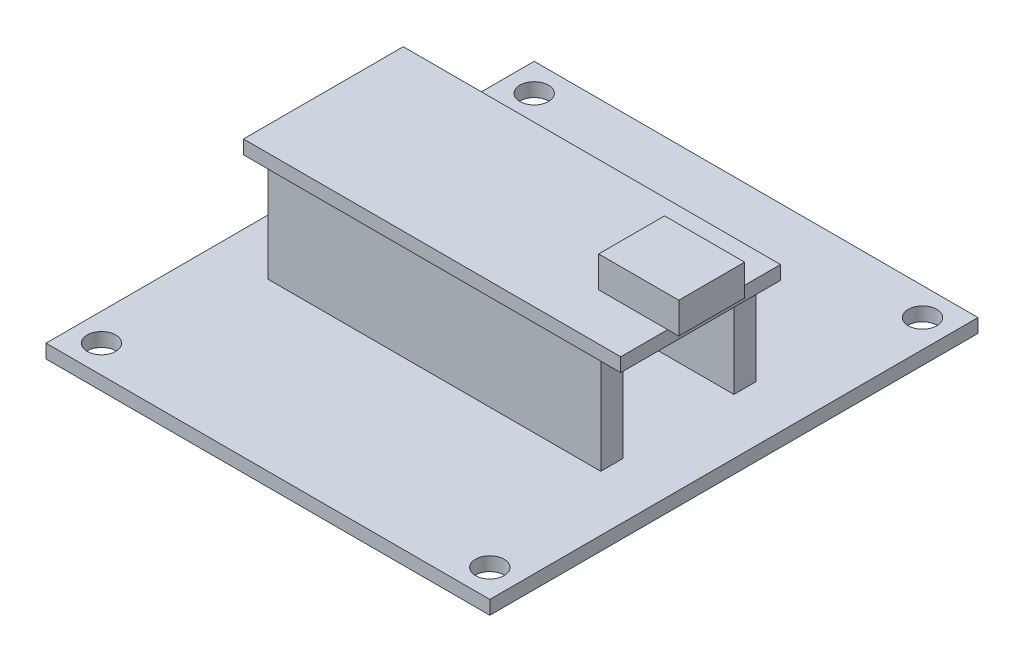
from build123d import *

# Parameters (mm, degrees)
SKETCH1_W                 = 50.8
SKETCH1_H                 = 55.88
BOSS_EXTRUDE1_DEPTH       = 1.5748
F_4_CLEARANCE_HOLE1_D     = 3.2639
F_4_CLEARANCE_HOLE1_DEPTH = 76.2
F_4_CLEARANCE_HOLE1_TIP   = 0.980574487
SKETCH4_W                 = 38.1
SKETCH4_H                 = 2.54
BOSS_EXTRUDE2_DEPTH       = 11.176
SKETCH5_W                 = 43.18
SKETCH5_H                 = 18.288
BOSS_EXTRUDE3_DEPTH       = 1.5748
SKETCH6_W                 = 9.1694
SKETCH6_H                 = 7.5438
BOSS_EXTRUDE4_DEPTH       = 3.556


with BuildPart() as part:
    # Sketch1 → Boss-Extrude1 (new body)
    with BuildSketch(Plane(origin=(0, 0, 0), x_dir=(1, 0, 0), z_dir=(0, 1, 0))):
        Rectangle(SKETCH1_W, SKETCH1_H)
    extrude(amount=BOSS_EXTRUDE1_DEPTH)

    # #4 Clearance Hole1
    with Locations(Plane(origin=(0, 1.5748, 0), x_dir=(-1, 0, 0), z_dir=(0, 1, 0))):
        with Locations((22.225, 24.765), (22.225, -24.765), (-22.225, -24.765), (-22.225, 24.765)):
            Hole(F_4_CLEARANCE_HOLE1_D / 2, depth=F_4_CLEARANCE_HOLE1_DEPTH)
            with Locations((0, 0, -(F_4_CLEARANCE_HOLE1_DEPTH + F_4_CLEARANCE_HOLE1_TIP / 2))):  # 118° drill point
                Cone(0, F_4_CLEARANCE_HOLE1_D / 2, F_4_CLEARANCE_HOLE1_TIP, mode=Mode.SUBTRACT)

    # Sketch4 → Boss-Extrude2 (add)
    with BuildSketch(Plane(origin=(0, 1.5748, 0), x_dir=(1, 0, 0), z_dir=(0, 1, 0))):
        with Locations((0, -7.62)):
            Rectangle(SKETCH4_W, SKETCH4_H)
        with Locations((0, 7.62)):
            Rectangle(SKETCH4_W, SKETCH4_H)
    extrude(amount=BOSS_EXTRUDE2_DEPTH)

    # Sketch5 → Boss-Extrude3 (add)
    with BuildSketch(Plane(origin=(0, 12.7508, 0), x_dir=(1, 0, 0), z_dir=(0, 1, 0))):
        Rectangle(SKETCH5_W, SKETCH5_H)
    extrude(amount=BOSS_EXTRUDE3_DEPTH)

    # Sketch6 → Boss-Extrude4 (add)
    with BuildSketch(Plane(origin=(0, 14.3256, 0), x_dir=(1, 0, 0), z_dir=(0, 1, 0))):
        with Locations((18.2753, 0)):
            Rectangle(SKETCH6_W, SKETCH6_H)
    extrude(amount=BOSS_EXTRUDE4_DEPTH)


solid = part.part
